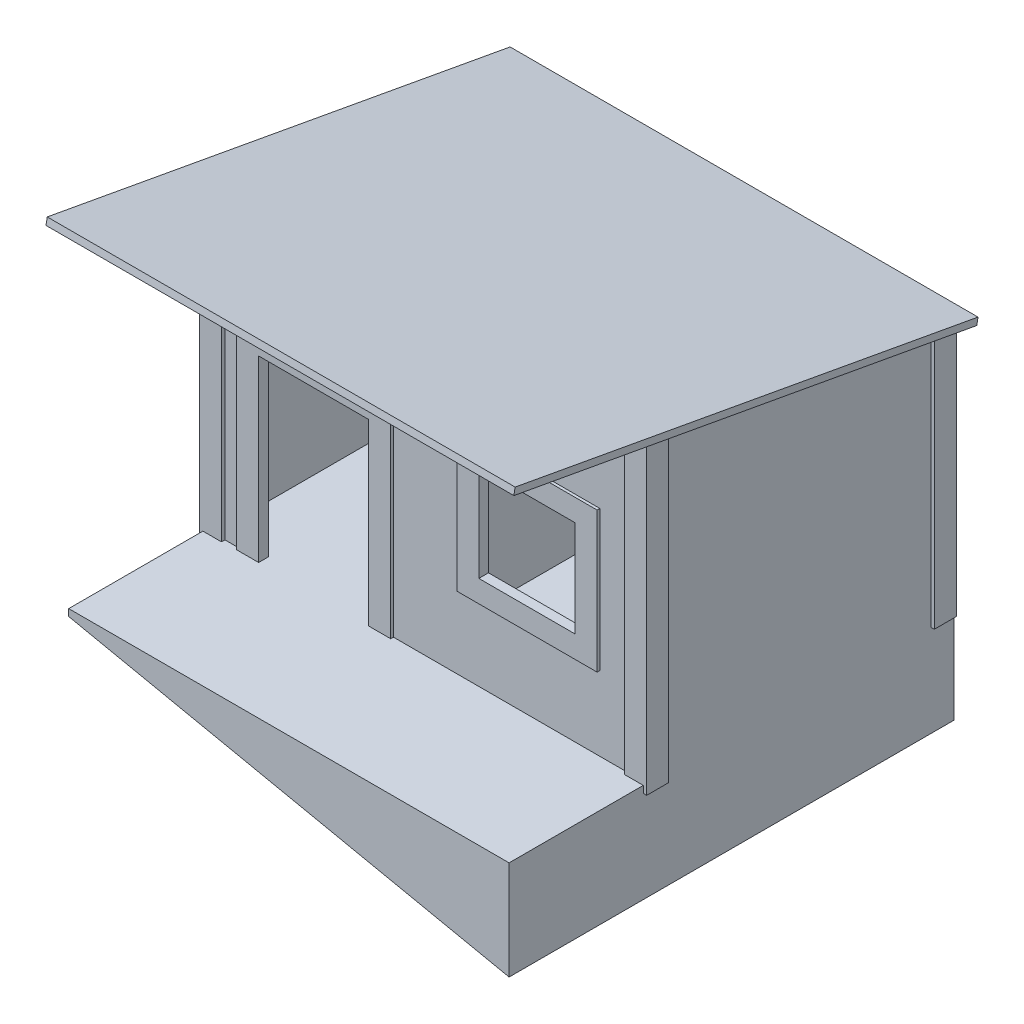
from build123d import *

# Parameters (mm, degrees)
SKETCH1_W                = 1600
SKETCH1_H                = 1600
BOSS_EXTRUDE1_DEPTH      = 25
SKETCH2_W                = 1600
SKETCH2_H                = 1100
SKETCH2_W_2              = 1550
SKETCH2_H_2              = 1050
BOSS_EXTRUDE2_DEPTH      = 1100
BOSS_EXTRUDE3_DEPTH      = 50
BOSS_EXTRUDE3_DEPTH_BACK = 1650
CUT_EXTRUDE1_DEPTH       = 2648.749751348
BOSS_EXTRUDE4_DEPTH      = 12.5
BOSS_EXTRUDE5_DEPTH      = 67.5
SKETCH8_W                = 400
SKETCH8_H                = 650
SKETCH8_W_2              = 350
SKETCH8_H_2              = 350
CUT_EXTRUDE2_DEPTH       = 68.5
SKETCH9_W                = 510
SKETCH9_H                = 510
SKETCH9_W_2              = 350
SKETCH9_H_2              = 350
BOSS_EXTRUDE6_DEPTH      = 10
BOSS_EXTRUDE7_REACH      = 2638.073
SKETCH10_W               = 50
SKETCH10_H               = 50
SCALE1_SCALE             = 0.125
SCALE2_SCALE             = 0.5
BOSS_EXTRUDE9_DEPTH      = 101


with BuildPart() as part:
    # Sketch1 → Boss-Extrude1 (new body)
    with BuildSketch(Plane(origin=(0, 0, 0), x_dir=(1, 0, 0), z_dir=(0, 1, 0))):
        with Locations((800, 800)):
            Rectangle(SKETCH1_W, SKETCH1_H)
    extrude(amount=BOSS_EXTRUDE1_DEPTH)

    # Sketch2 → Boss-Extrude2 (add)
    with BuildSketch(Plane(origin=(0, 25, 0), x_dir=(1, 0, 0), z_dir=(0, 1, 0))):
        with Locations((800, 1050)):
            Rectangle(SKETCH2_W, SKETCH2_H)
        with Locations((800, 1050)):
            Rectangle(SKETCH2_W_2, SKETCH2_H_2, mode=Mode.SUBTRACT)
    extrude(amount=BOSS_EXTRUDE2_DEPTH)

    # Sketch3 → Boss-Extrude3 (add, two sides: drawn at the far end of the back side and taken through both)
    with BuildSketch(Plane(origin=(1600, 0, 0), x_dir=(0, 0, -1), z_dir=(1, 0, 0)).offset(-BOSS_EXTRUDE3_DEPTH_BACK)):
        Polygon((1600, 925), (500, 1125), (-32.556177987, 1221.828395998), (-28.084042032, 1246.42514375), (1653.633304815, 940.474679295), (1649.193495505, 916.05572809), align=None)
    extrude(amount=BOSS_EXTRUDE3_DEPTH + BOSS_EXTRUDE3_DEPTH_BACK)

    # Sketch4 → Cut-Extrude1 (cut, through all)
    with BuildSketch(Plane(origin=(1600, 0, 0), x_dir=(0, 0, -1), z_dir=(1, 0, 0))):
        Polygon((-28.084042032, 1246.42514375), (1653.633304815, 940.474679295), (1653.633304815, 1246.42514375), align=None)
    extrude(amount=-CUT_EXTRUDE1_DEPTH, mode=Mode.SUBTRACT)

    # Sketch5 → Boss-Extrude4 (add)
    with BuildSketch(Plane(origin=(1600, 0, 0), x_dir=(0, 0, -1), z_dir=(1, 0, 0))):
        Polygon((1532.5, 937.272727273), (1532.5, 0), (1612.5, 0), (1612.5, 922.727272727), align=None)
        Polygon((567.5, 1112.727272727), (567.5, 0), (487.5, 0), (487.5, 1127.272727273), align=None)
    boss_extrude4 = extrude(amount=BOSS_EXTRUDE4_DEPTH)

    # Sketch6 → Boss-Extrude5 (add)
    with BuildSketch(Plane.ZY.offset(-1600)):
        Polygon((-1600, 925), (-1600, 0), (-1612.5, 0), (-1612.5, 922.727272727), align=None)
        Polygon((-487.5, 1127.272727273), (-500, 1125), (-500, 25), (-487.5, 25), align=None)
    boss_extrude5 = extrude(amount=BOSS_EXTRUDE5_DEPTH)

    # Mirror1: Boss-Extrude4, Boss-Extrude5 across plane
    add(boss_extrude4.mirror(Plane(origin=(800, 0, 0), x_dir=(0, 0, 1), z_dir=(1, 0, 0))))
    add(boss_extrude5.mirror(Plane(origin=(800, 0, 0), x_dir=(0, 0, 1), z_dir=(1, 0, 0))))

    # Sketch8 → Cut-Extrude2 (cut)
    with BuildSketch(Plane.XY.offset(-500)):
        with Locations((400, 350)):
            Rectangle(SKETCH8_W, SKETCH8_H)
        with Locations((1175, 550)):
            Rectangle(SKETCH8_W_2, SKETCH8_H_2)
    extrude(amount=-CUT_EXTRUDE2_DEPTH, mode=Mode.SUBTRACT)

    # Sketch9 → Boss-Extrude6 (add)
    # profile 1 of 2: a face of its own
    with BuildSketch(Plane.XY.offset(-500)):
        Polygon((200, 25), (200, 673.570628699), (200, 675), (600, 675), (600, 673.570628699), (600, 25), (680, 25), (680, 753.570628699), (120, 753.570628699), (120, 25), align=None)
    # profile 2 of 2: a face of its own
    with BuildSketch(Plane.XY.offset(-500)):
        with Locations((1175, 550)):
            Rectangle(SKETCH9_W, SKETCH9_H)
        with Locations((1175, 550)):
            Rectangle(SKETCH9_W_2, SKETCH9_H_2, mode=Mode.SUBTRACT)
    extrude(amount=BOSS_EXTRUDE6_DEPTH)

    # Boss-Extrude7: up to this plane
    boss_extrude7_end = Plane(origin=(1650, 925, -1600), z_dir=(0, 0.9838699100999074, -0.1788854381999831))
    # Sketch10 → Boss-Extrude7 (add, up to the surface)
    with BuildSketch(Plane(origin=(0, 25, 0), x_dir=(1, 0, 0), z_dir=(0, 1, 0)), mode=Mode.PRIVATE) as boss_extrude7_sk1:
        with Locations((50, 1550)):
            Rectangle(SKETCH10_W, SKETCH10_H)
    boss_extrude7_tool1 = split(extrude(boss_extrude7_sk1.sketch, amount=BOSS_EXTRUDE7_REACH, mode=Mode.PRIVATE), bisect_by=boss_extrude7_end, keep=Keep.BOTH, mode=Mode.PRIVATE)
    add(boss_extrude7_tool1.solids().sort_by_distance((50, 25, -1550))[0])
    # Sketch10 → Boss-Extrude7 (add, up to the surface)
    with BuildSketch(Plane(origin=(0, 25, 0), x_dir=(1, 0, 0), z_dir=(0, 1, 0)), mode=Mode.PRIVATE) as boss_extrude7_sk2:
        with Locations((1550, 1550)):
            Rectangle(SKETCH10_W, SKETCH10_H)
    boss_extrude7_tool2 = split(extrude(boss_extrude7_sk2.sketch, amount=BOSS_EXTRUDE7_REACH, mode=Mode.PRIVATE), bisect_by=boss_extrude7_end, keep=Keep.BOTH, mode=Mode.PRIVATE)
    add(boss_extrude7_tool2.solids().sort_by_distance((1550, 25, -1550))[0])
    # Sketch10 → Boss-Extrude7 (add, up to the surface)
    with BuildSketch(Plane(origin=(0, 25, 0), x_dir=(1, 0, 0), z_dir=(0, 1, 0)), mode=Mode.PRIVATE) as boss_extrude7_sk3:
        with Locations((50, 550)):
            Rectangle(SKETCH10_W, SKETCH10_H)
    boss_extrude7_tool3 = split(extrude(boss_extrude7_sk3.sketch, amount=BOSS_EXTRUDE7_REACH, mode=Mode.PRIVATE), bisect_by=boss_extrude7_end, keep=Keep.BOTH, mode=Mode.PRIVATE)
    add(boss_extrude7_tool3.solids().sort_by_distance((50, 25, -550))[0])
    # Sketch10 → Boss-Extrude7 (add, up to the surface)
    with BuildSketch(Plane(origin=(0, 25, 0), x_dir=(1, 0, 0), z_dir=(0, 1, 0)), mode=Mode.PRIVATE) as boss_extrude7_sk4:
        with Locations((1550, 550)):
            Rectangle(SKETCH10_W, SKETCH10_H)
    boss_extrude7_tool4 = split(extrude(boss_extrude7_sk4.sketch, amount=BOSS_EXTRUDE7_REACH, mode=Mode.PRIVATE), bisect_by=boss_extrude7_end, keep=Keep.BOTH, mode=Mode.PRIVATE)
    add(boss_extrude7_tool4.solids().sort_by_distance((1550, 25, -550))[0])
    # Sketch10 → Boss-Extrude7 (add, up to the surface)
    with BuildSketch(Plane(origin=(0, 25, 0), x_dir=(1, 0, 0), z_dir=(0, 1, 0)), mode=Mode.PRIVATE) as boss_extrude7_sk5:
        Polygon((725, 525), (750, 525), (800, 525), (800, 575), (750, 575), (750, 1125), (800, 1125), (800, 1175), (750, 1175), (725, 1175), align=None)
    boss_extrude7_tool5 = split(extrude(boss_extrude7_sk5.sketch, amount=BOSS_EXTRUDE7_REACH, mode=Mode.PRIVATE), bisect_by=boss_extrude7_end, keep=Keep.BOTH, mode=Mode.PRIVATE)
    add(boss_extrude7_tool5.solids().sort_by_distance((746.323529, 25, -850))[0])


with BuildPart() as part_1:
    # Scale1: scaled about (0, 0, 0)
    add(part.part.scale(SCALE1_SCALE))


with BuildPart() as part_2:
    # Scale2: scaled about (0, 0, 0)
    add(part_1.part.scale(SCALE2_SCALE))

    # Sketch11 → Boss-Extrude9 (add)
    with BuildSketch(Plane.XY):
        Polygon((0, 0), (100, 0), (100, -20.901409281), align=None)
    extrude(amount=-BOSS_EXTRUDE9_DEPTH)


solid = part_2.part
